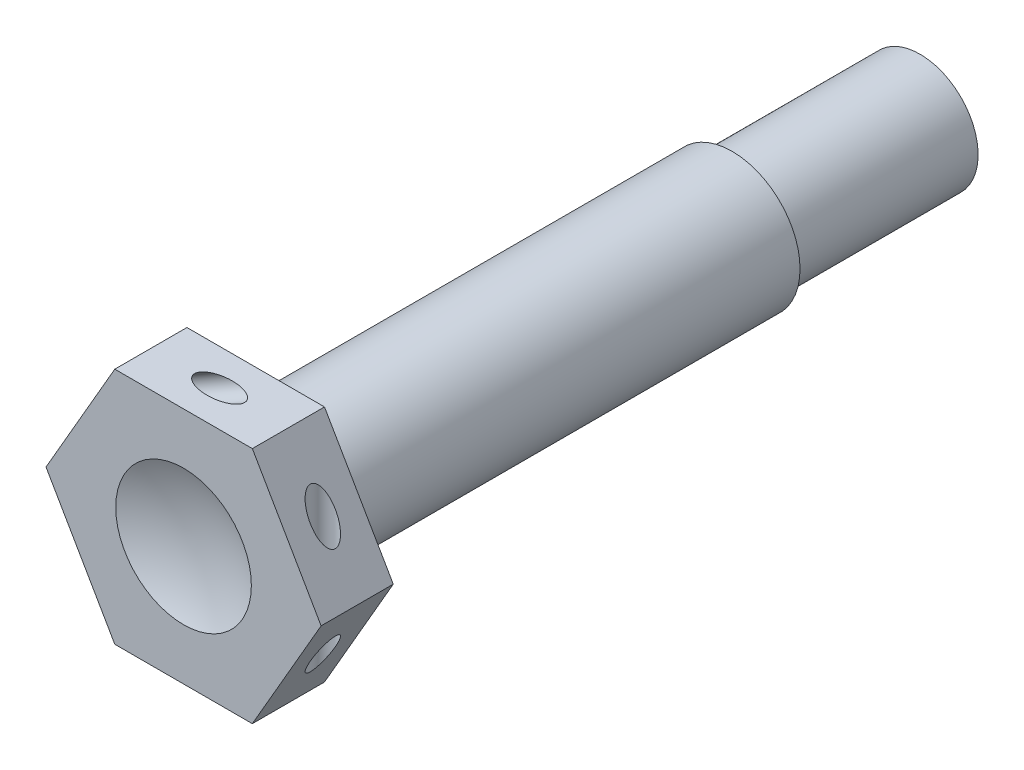
from build123d import *

# Parameters (mm, degrees)
BOSS_EXTRUDE1_DEPTH = 3.3655
SKETCH2_R           = 3.1623
BOSS_EXTRUDE2_DEPTH = 22.225
SKETCH3_R           = 2.7051
BOSS_EXTRUDE3_DEPTH = 8.763
SKETCH5_R           = 0.5842
CUT_EXTRUDE1_DEPTH  = 33.129279639
CIRPATTERN1_COUNT   = 3


with BuildPart() as part:
    # Sketch1 → Boss-Extrude1 (new body)
    with BuildSketch(Plane.XY):
        Polygon((3.207902433, 5.55625), (-3.207902433, 5.55625), (-6.415804866, 0), (-3.207902433, -5.55625), (3.207902433, -5.55625), (6.415804866, 0), align=None)
    extrude(amount=BOSS_EXTRUDE1_DEPTH)

    # Sketch2 → Boss-Extrude2 (add)
    with BuildSketch(Plane(origin=(0, 0, 0), x_dir=(-1, 0, 0), z_dir=(0, 0, -1))):
        Circle(SKETCH2_R)
    extrude(amount=BOSS_EXTRUDE2_DEPTH)

    # Sketch3 → Boss-Extrude3 (add)
    with BuildSketch(Plane(origin=(0, 0, -22.225), x_dir=(-1, 0, 0), z_dir=(0, 0, -1))):
        Circle(SKETCH3_R)
    extrude(amount=BOSS_EXTRUDE3_DEPTH)

    # Sketch4 → Cut-Revolve1 (revolve, cut)
    with BuildSketch(Plane(origin=(0, 0, 0), x_dir=(0, 0, -1), z_dir=(1, 0, 0))):
        with BuildLine():
            Line((-3.3655, 0), (-3.3655, 3.1623))
            ThreePointArc((-3.3655, 3.1623), (-2.841803396, 1.619539554), (-2.664434968, 0))
            Line((-2.664434968, 0), (-3.3655, 0))
        make_face()
    revolve(axis=Axis((0, 0, 3.3655), (0, 0, -1)), mode=Mode.SUBTRACT)

    # Sketch5 → Cut-Extrude1 (cut, symmetric)
    with BuildSketch(Plane(origin=(0, 0, 0), x_dir=(1, 0, 0), z_dir=(0, 1, 0))):
        with Locations((4.81185365, -1.68275)):
            Circle(SKETCH5_R)
    cut_extrude1 = extrude(amount=CUT_EXTRUDE1_DEPTH, both=True, mode=Mode.SUBTRACT)

    # CirPattern1: Cut-Extrude1 ×3 about axis
    cirpattern1_axis = Axis((0, 0, -32.705675), (0, 0, 1))
    for i in range(1, CIRPATTERN1_COUNT):
        add(cut_extrude1.rotate(cirpattern1_axis, i * 360 / CIRPATTERN1_COUNT), mode=Mode.SUBTRACT)


solid = part.part
